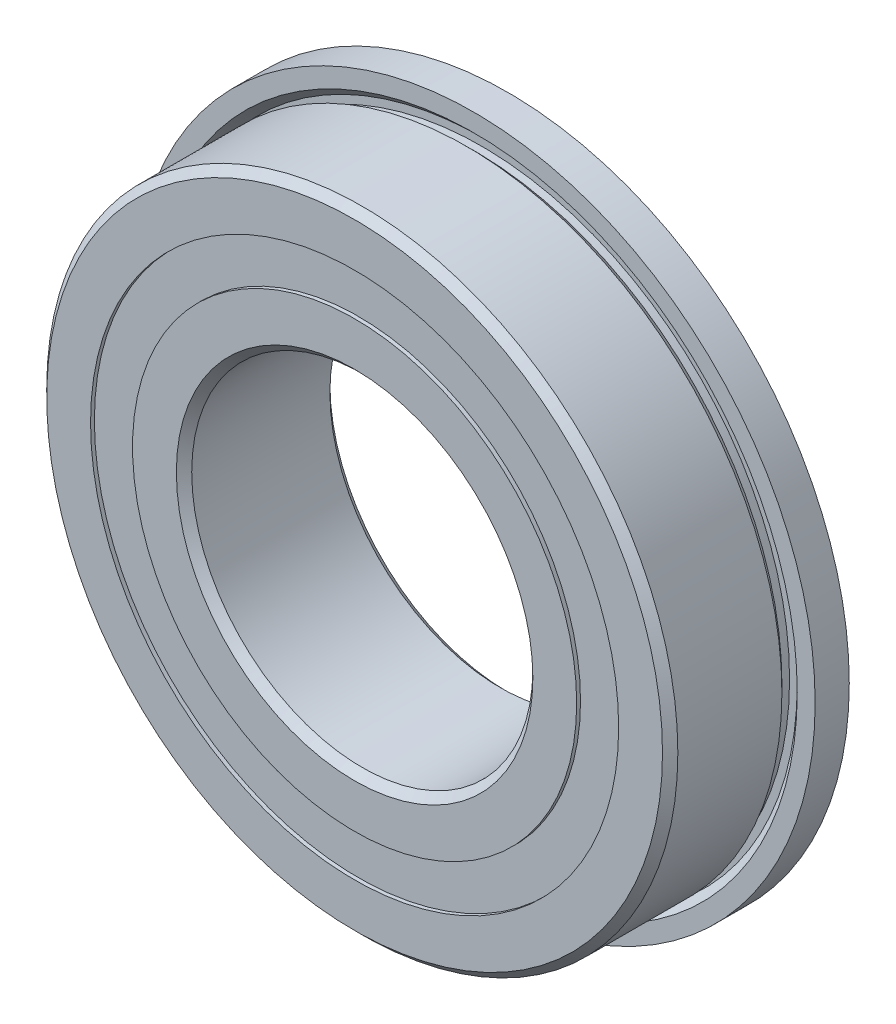
from build123d import *

# Parameters (mm, degrees)
SKETCH6_W         = 0.41025641
SKETCH6_H         = 1.23076923
CIRPATTERN1_COUNT = 11
SKETCH5_W         = 1.926640381
SKETCH5_H         = 2.461538462


with BuildPart() as part:
    # Sketch7 → Revolve7 (revolve)
    with BuildSketch(Plane(origin=(0, 0, 0), x_dir=(0, 0, -1), z_dir=(1, 0, 0))):
        with BuildLine():
            Line((4.5, 20), (2.5, 20))
            Line((2.5, 20), (2.5, 18.95))
            Line((2.5, 18.95), (2.95, 18.5))
            Line((2.95, 18.5), (2.95, 18.05))
            Line((2.95, 18.05), (2.5, 18.05))
            Line((2.5, 18.05), (2.05, 18.5))
            Line((2.05, 18.5), (-4.05, 18.5))
            Line((-4.05, 18.5), (-4.5, 18.05))
            Line((-4.5, 18.05), (-4.5, 15.480769231))
            Line((-4.5, 15.480769231), (-2, 15.480769231))
            ThreePointArc((-2, 15.480769231), (0, 16.598359619), (2, 15.480769231))
            Line((2, 15.480769231), (4.5, 15.480769231))
            Line((4.5, 15.480769231), (4.5, 18.05))
            Line((4.5, 18.05), (4.5, 20))
        make_face()
    revolve(axis=Axis((0, 0, 4.5), (0, 0, -1)))


with BuildPart() as body_2:
    # Sketch3 → Revolve3 (revolve)
    with BuildSketch(Plane(origin=(0, 0, 0), x_dir=(0, 0, -1), z_dir=(1, 0, 0))):
        with BuildLine():
            Line((-4.5, 13.019230769), (-2, 13.019230769))
            ThreePointArc((-2, 13.019230769), (0, 11.901640381), (2, 13.019230769))
            Line((2, 13.019230769), (4.5, 13.019230769))
            Line((4.5, 13.019230769), (4.5, 10.45))
            Line((4.5, 10.45), (4.05, 10))
            Line((4.05, 10), (-4.05, 10))
            Line((-4.05, 10), (-4.5, 10.45))
            Line((-4.5, 10.45), (-4.5, 13.019230769))
        make_face()
    revolve(axis=Axis((0, 0, 4.5), (0, 0, -1)))


with BuildPart() as body_3:
    # Sketch6 → Revolve6 (revolve)
    with BuildSketch(Plane(origin=(0, 0, 0), x_dir=(0, 0, -1), z_dir=(1, 0, 0))):
        with Locations((0, 14.25)):
            Rectangle(SKETCH6_W, SKETCH6_H)
    revolve(axis=Axis((0, 0, 4.5), (0, 0, -1)))


with BuildPart() as body_4:
    # Sketch4 → Revolve4 (revolve)
    with BuildSketch(Plane(origin=(0, 0, 0), x_dir=(0, 0, -1), z_dir=(1, 0, 0))):
        with BuildLine():
            Line((-2.348359619, 14.25), (2.348359619, 14.25))
            ThreePointArc((2.348359619, 14.25), (0, 16.598359619), (-2.348359619, 14.25))
        make_face()
    revolve(axis=Axis((0, 14.25, 2.348359619), (0, 0, -1)))


with BuildPart() as cirpattern1_1:
    # CirPattern1: pattern copy
    add(body_4.part.rotate(Axis((0, 0, -4.5), (0, 0, 1)), 1 * 360 / CIRPATTERN1_COUNT))


with BuildPart() as cirpattern1_2:
    # CirPattern1: pattern copy
    add(body_4.part.rotate(Axis((0, 0, -4.5), (0, 0, 1)), 2 * 360 / CIRPATTERN1_COUNT))


with BuildPart() as cirpattern1_3:
    # CirPattern1: pattern copy
    add(body_4.part.rotate(Axis((0, 0, -4.5), (0, 0, 1)), 3 * 360 / CIRPATTERN1_COUNT))


with BuildPart() as cirpattern1_4:
    # CirPattern1: pattern copy
    add(body_4.part.rotate(Axis((0, 0, -4.5), (0, 0, 1)), 4 * 360 / CIRPATTERN1_COUNT))


with BuildPart() as cirpattern1_5:
    # CirPattern1: pattern copy
    add(body_4.part.rotate(Axis((0, 0, -4.5), (0, 0, 1)), 5 * 360 / CIRPATTERN1_COUNT))


with BuildPart() as cirpattern1_6:
    # CirPattern1: pattern copy
    add(body_4.part.rotate(Axis((0, 0, -4.5), (0, 0, 1)), 6 * 360 / CIRPATTERN1_COUNT))


with BuildPart() as cirpattern1_7:
    # CirPattern1: pattern copy
    add(body_4.part.rotate(Axis((0, 0, -4.5), (0, 0, 1)), 7 * 360 / CIRPATTERN1_COUNT))


with BuildPart() as cirpattern1_8:
    # CirPattern1: pattern copy
    add(body_4.part.rotate(Axis((0, 0, -4.5), (0, 0, 1)), 8 * 360 / CIRPATTERN1_COUNT))


with BuildPart() as cirpattern1_9:
    # CirPattern1: pattern copy
    add(body_4.part.rotate(Axis((0, 0, -4.5), (0, 0, 1)), 9 * 360 / CIRPATTERN1_COUNT))


with BuildPart() as cirpattern1_10:
    # CirPattern1: pattern copy
    add(body_4.part.rotate(Axis((0, 0, -4.5), (0, 0, 1)), 10 * 360 / CIRPATTERN1_COUNT))


with BuildPart() as body_15:
    # Sketch5 → Revolve5 (revolve)
    with BuildSketch(Plane(origin=(0, 0, 0), x_dir=(0, 0, -1), z_dir=(1, 0, 0))):
        with Locations((-3.31167981, 14.25)):
            Rectangle(SKETCH5_W, SKETCH5_H)
        with Locations((3.31167981, 14.25)):
            Rectangle(SKETCH5_W, SKETCH5_H)
    revolve(axis=Axis((0, 0, 4.5), (0, 0, -1)))


solid = Compound([part.part, body_2.part, body_3.part, body_4.part, cirpattern1_1.part, cirpattern1_2.part, cirpattern1_3.part, cirpattern1_4.part, cirpattern1_5.part, cirpattern1_6.part, cirpattern1_7.part, cirpattern1_8.part, cirpattern1_9.part, cirpattern1_10.part, body_15.part])
